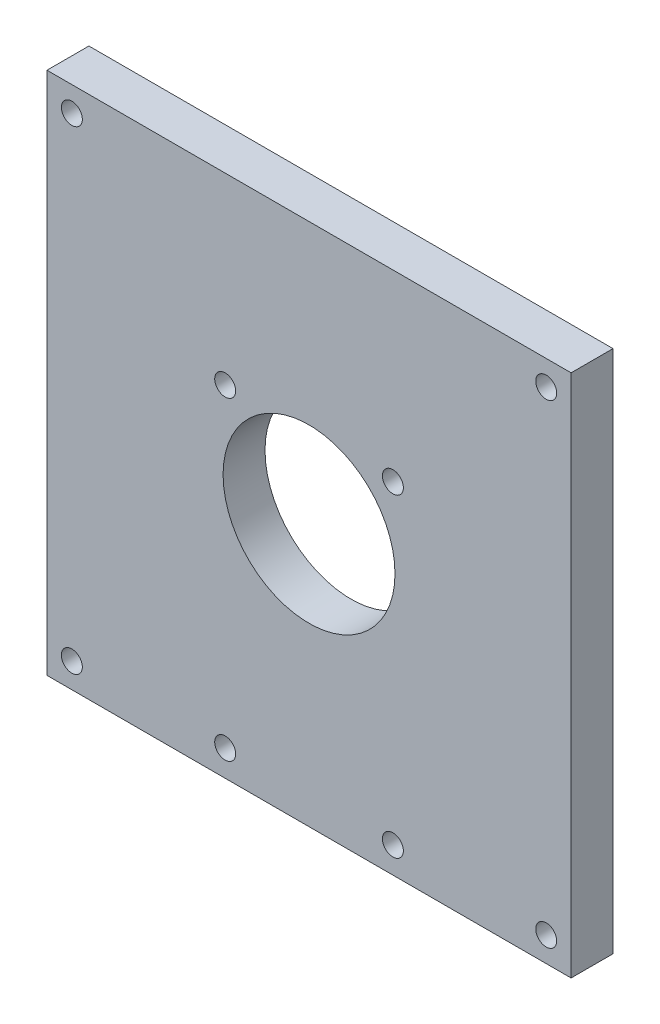
from build123d import *

# Parameters (mm, degrees)
SKETCH1_W           = 50
SKETCH1_H           = 50
SKETCH1_R           = 1
BOSS_EXTRUDE1_DEPTH = 4
SKETCH2_R           = 8.2
SKETCH2_R_2         = 1
CUT_EXTRUDE1_DEPTH  = 10


with BuildPart() as part:
    # Sketch1 → Boss-Extrude1 (new body)
    with BuildSketch(Plane.XY):
        Rectangle(SKETCH1_W, SKETCH1_H)
        with Locations((-22.627416998, 22.627416998)):
            Circle(SKETCH1_R, mode=Mode.SUBTRACT)
        with Locations((22.627416998, 22.627416998)):
            Circle(SKETCH1_R, mode=Mode.SUBTRACT)
        with Locations((22.627416998, -22.627416998)):
            Circle(SKETCH1_R, mode=Mode.SUBTRACT)
        with Locations((-22.627416998, -22.627416998)):
            Circle(SKETCH1_R, mode=Mode.SUBTRACT)
    extrude(amount=BOSS_EXTRUDE1_DEPTH)

    # Sketch2 → Cut-Extrude1 (cut)
    with BuildSketch(Plane.XY.offset(4)):
        Circle(SKETCH2_R)
        with Locations((-8, 7.5)):
            Circle(SKETCH2_R_2)
        with Locations((8, 7.5)):
            Circle(SKETCH2_R_2)
        with Locations((-8, -22.5)):
            Circle(SKETCH2_R_2)
        with Locations((8, -22.5)):
            Circle(SKETCH2_R_2)
    extrude(amount=-CUT_EXTRUDE1_DEPTH, mode=Mode.SUBTRACT)


solid = part.part
